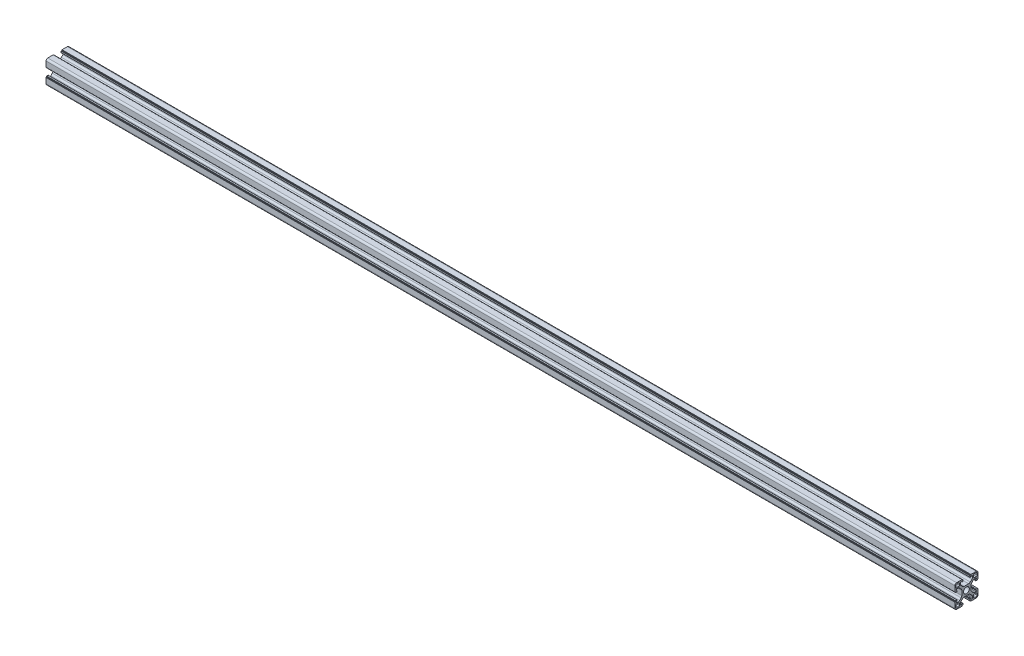
from build123d import *

# Parameters (mm, degrees)
EXTRUDE_1_DEPTH = 785


with BuildPart() as part:
    # Эскиз1 → Бобышка-Вытянуть1 (new body)
    with BuildSketch(Plane(origin=(0, 0, 0), x_dir=(0, 0, -1), z_dir=(1, 0, 0))):
        with BuildLine():
            Line((0.129852449, 4.683728486), (2.028633118, 4.683728486))
            ThreePointArc((2.028633118, 4.683728486), (2.793999983, 4.835969421), (3.44284668, 5.269514923))
            Line((3.44284668, 5.269514923), (4.744066011, 6.570734254))
            ThreePointArc((4.744066011, 6.570734254), (5.177611514, 7.219580952), (5.329852449, 7.984947817))
            Line((5.329852449, 7.984947817), (5.329852449, 8.883728486))
            ThreePointArc((5.329852449, 8.883728486), (5.183405839, 9.237281876), (4.829852449, 9.383728486))
            Line((4.829852449, 9.383728486), (4.72695923, 9.383728486))
            ThreePointArc((4.72695923, 9.383728486), (4.535617514, 9.345668252), (4.373405839, 9.237281876))
            Line((4.373405839, 9.237281876), (3.893075754, 8.75695179))
            ThreePointArc((3.893075754, 8.75695179), (3.811969916, 8.702758603), (3.716299058, 8.683728486))
            Line((3.716299058, 8.683728486), (3.429852449, 8.683728486))
            ThreePointArc((3.429852449, 8.683728486), (3.253075754, 8.75695179), (3.179852449, 8.933728486))
            Line((3.179852449, 8.933728486), (3.179852449, 10.082799306))
            ThreePointArc((3.179852449, 10.082799306), (3.223786432, 10.188865323), (3.329852449, 10.232799306))
            Line((3.329852449, 10.232799306), (3.829852449, 10.232799306))
            Line((3.829852449, 10.232799306), (3.829852449, 10.533728486))
            ThreePointArc((3.829852449, 10.533728486), (3.873786432, 10.639794503), (3.979852449, 10.683728486))
            Line((3.979852449, 10.683728486), (8.629852449, 10.683728486))
            ThreePointArc((8.629852449, 10.683728486), (9.690512621, 10.244388658), (10.129852449, 9.183728486))
            Line((10.129852449, 9.183728486), (10.129852449, 4.533728486))
            ThreePointArc((10.129852449, 4.533728486), (10.085918466, 4.427662469), (9.979852449, 4.383728486))
            Line((9.979852449, 4.383728486), (9.678923269, 4.383728486))
            Line((9.678923269, 4.383728486), (9.678923269, 3.883728486))
            ThreePointArc((9.678923269, 3.883728486), (9.634989287, 3.777662469), (9.528923269, 3.733728486))
            Line((9.528923269, 3.733728486), (8.379852449, 3.733728486))
            ThreePointArc((8.379852449, 3.733728486), (8.203075754, 3.80695179), (8.129852449, 3.983728486))
            Line((8.129852449, 3.983728486), (8.129852449, 4.270175095))
            ThreePointArc((8.129852449, 4.270175095), (8.148882566, 4.365845953), (8.203075754, 4.44695179))
            Line((8.203075754, 4.44695179), (8.683405839, 4.927281876))
            ThreePointArc((8.683405839, 4.927281876), (8.791792215, 5.089493551), (8.829852449, 5.280835267))
            Line((8.829852449, 5.280835267), (8.829852449, 5.383728486))
            ThreePointArc((8.829852449, 5.383728486), (8.683405839, 5.737281876), (8.329852449, 5.883728486))
            Line((8.329852449, 5.883728486), (7.43107178, 5.883728486))
            ThreePointArc((7.43107178, 5.883728486), (6.665704915, 5.731487551), (6.016858217, 5.297942048))
            Line((6.016858217, 5.297942048), (4.715638886, 3.996722717))
            ThreePointArc((4.715638886, 3.996722717), (4.282093384, 3.34787602), (4.129852449, 2.582509155))
            Line((4.129852449, 2.582509155), (4.129852449, 0.683728486))
            Line((4.129852449, 0.683728486), (4.129852449, -1.215052183))
            ThreePointArc((4.129852449, -1.215052183), (4.282093384, -1.980419048), (4.715638886, -2.629265746))
            Line((4.715638886, -2.629265746), (6.016858217, -3.930485077))
            ThreePointArc((6.016858217, -3.930485077), (6.665704915, -4.364030579), (7.43107178, -4.516271514))
            Line((7.43107178, -4.516271514), (8.329852449, -4.516271514))
            ThreePointArc((8.329852449, -4.516271514), (8.683405839, -4.369824905), (8.829852449, -4.016271514))
            Line((8.829852449, -4.016271514), (8.829852449, -3.913378295))
            ThreePointArc((8.829852449, -3.913378295), (8.791792215, -3.722036579), (8.683405839, -3.559824905))
            Line((8.683405839, -3.559824905), (8.203075754, -3.079494819))
            ThreePointArc((8.203075754, -3.079494819), (8.148882566, -2.998388982), (8.129852449, -2.902718124))
            Line((8.129852449, -2.902718124), (8.129852449, -2.616271514))
            ThreePointArc((8.129852449, -2.616271514), (8.203075754, -2.439494819), (8.379852449, -2.366271514))
            Line((8.379852449, -2.366271514), (9.528923269, -2.366271514))
            ThreePointArc((9.528923269, -2.366271514), (9.634989287, -2.410205497), (9.678923269, -2.516271514))
            Line((9.678923269, -2.516271514), (9.678923269, -3.016271514))
            Line((9.678923269, -3.016271514), (9.979852449, -3.016271514))
            ThreePointArc((9.979852449, -3.016271514), (10.085918466, -3.060205497), (10.129852449, -3.166271514))
            Line((10.129852449, -3.166271514), (10.129852449, -7.816271514))
            ThreePointArc((10.129852449, -7.816271514), (9.690512621, -8.876931686), (8.629852449, -9.316271514))
            Line((8.629852449, -9.316271514), (3.979852449, -9.316271514))
            ThreePointArc((3.979852449, -9.316271514), (3.873786432, -9.272337531), (3.829852449, -9.166271514))
            Line((3.829852449, -9.166271514), (3.829852449, -8.865342335))
            Line((3.829852449, -8.865342335), (3.329852449, -8.865342335))
            ThreePointArc((3.329852449, -8.865342335), (3.223786432, -8.821408352), (3.179852449, -8.715342335))
            Line((3.179852449, -8.715342335), (3.179852449, -7.566271514))
            ThreePointArc((3.179852449, -7.566271514), (3.253075754, -7.389494819), (3.429852449, -7.316271514))
            Line((3.429852449, -7.316271514), (3.716299058, -7.316271514))
            ThreePointArc((3.716299058, -7.316271514), (3.811969916, -7.335301631), (3.893075754, -7.389494819))
            Line((3.893075754, -7.389494819), (4.373405839, -7.869824905))
            ThreePointArc((4.373405839, -7.869824905), (4.535617514, -7.978211281), (4.72695923, -8.016271514))
            Line((4.72695923, -8.016271514), (4.829852449, -8.016271514))
            ThreePointArc((4.829852449, -8.016271514), (5.183405839, -7.869824905), (5.329852449, -7.516271514))
            Line((5.329852449, -7.516271514), (5.329852449, -6.617490845))
            ThreePointArc((5.329852449, -6.617490845), (5.177611514, -5.85212398), (4.744066011, -5.203277283))
            Line((4.744066011, -5.203277283), (3.44284668, -3.902057952))
            ThreePointArc((3.44284668, -3.902057952), (2.793999983, -3.468512449), (2.028633118, -3.316271514))
            Line((2.028633118, -3.316271514), (0.129852449, -3.316271514))
            Line((0.129852449, -3.316271514), (-1.76892822, -3.316271514))
            ThreePointArc((-1.76892822, -3.316271514), (-2.534295085, -3.468512449), (-3.183141783, -3.902057952))
            Line((-3.183141783, -3.902057952), (-4.484361114, -5.203277283))
            ThreePointArc((-4.484361114, -5.203277283), (-4.917906616, -5.85212398), (-5.070147551, -6.617490845))
            Line((-5.070147551, -6.617490845), (-5.070147551, -7.516271514))
            ThreePointArc((-5.070147551, -7.516271514), (-4.923700942, -7.869824905), (-4.570147551, -8.016271514))
            Line((-4.570147551, -8.016271514), (-4.467254332, -8.016271514))
            ThreePointArc((-4.467254332, -8.016271514), (-4.275912616, -7.978211281), (-4.113700942, -7.869824905))
            Line((-4.113700942, -7.869824905), (-3.633370856, -7.389494819))
            ThreePointArc((-3.633370856, -7.389494819), (-3.552265019, -7.335301631), (-3.456594161, -7.316271514))
            Line((-3.456594161, -7.316271514), (-3.170147551, -7.316271514))
            ThreePointArc((-3.170147551, -7.316271514), (-2.993370856, -7.389494819), (-2.920147551, -7.566271514))
            Line((-2.920147551, -7.566271514), (-2.920147551, -8.715342335))
            ThreePointArc((-2.920147551, -8.715342335), (-2.964081534, -8.821408352), (-3.070147551, -8.865342335))
            Line((-3.070147551, -8.865342335), (-3.570147551, -8.865342335))
            Line((-3.570147551, -8.865342335), (-3.570147551, -9.166271514))
            ThreePointArc((-3.570147551, -9.166271514), (-3.614081534, -9.272337531), (-3.720147551, -9.316271514))
            Line((-3.720147551, -9.316271514), (-8.370147551, -9.316271514))
            ThreePointArc((-8.370147551, -9.316271514), (-9.430807723, -8.876931686), (-9.870147551, -7.816271514))
            Line((-9.870147551, -7.816271514), (-9.870147551, -3.166271514))
            ThreePointArc((-9.870147551, -3.166271514), (-9.826213568, -3.060205497), (-9.720147551, -3.016271514))
            Line((-9.720147551, -3.016271514), (-9.419218372, -3.016271514))
            Line((-9.419218372, -3.016271514), (-9.419218372, -2.516271514))
            ThreePointArc((-9.419218372, -2.516271514), (-9.375284389, -2.410205497), (-9.269218372, -2.366271514))
            Line((-9.269218372, -2.366271514), (-8.120147551, -2.366271514))
            ThreePointArc((-8.120147551, -2.366271514), (-7.943370856, -2.439494819), (-7.870147551, -2.616271514))
            Line((-7.870147551, -2.616271514), (-7.870147551, -2.902718124))
            ThreePointArc((-7.870147551, -2.902718124), (-7.889177668, -2.998388982), (-7.943370856, -3.079494819))
            Line((-7.943370856, -3.079494819), (-8.423700942, -3.559824905))
            ThreePointArc((-8.423700942, -3.559824905), (-8.532087317, -3.722036579), (-8.570147551, -3.913378295))
            Line((-8.570147551, -3.913378295), (-8.570147551, -4.016271514))
            ThreePointArc((-8.570147551, -4.016271514), (-8.423700942, -4.369824905), (-8.070147551, -4.516271514))
            Line((-8.070147551, -4.516271514), (-7.171366882, -4.516271514))
            ThreePointArc((-7.171366882, -4.516271514), (-6.406000017, -4.364030579), (-5.75715332, -3.930485077))
            Line((-5.75715332, -3.930485077), (-4.455933989, -2.629265746))
            ThreePointArc((-4.455933989, -2.629265746), (-4.022388486, -1.980419048), (-3.870147551, -1.215052183))
            Line((-3.870147551, -1.215052183), (-3.870147551, 0.683728486))
            Line((-3.870147551, 0.683728486), (-3.870147551, 2.582509155))
            ThreePointArc((-3.870147551, 2.582509155), (-4.022388486, 3.34787602), (-4.455933989, 3.996722717))
            Line((-4.455933989, 3.996722717), (-5.75715332, 5.297942048))
            ThreePointArc((-5.75715332, 5.297942048), (-6.406000017, 5.731487551), (-7.171366882, 5.883728486))
            Line((-7.171366882, 5.883728486), (-8.070147551, 5.883728486))
            ThreePointArc((-8.070147551, 5.883728486), (-8.423700942, 5.737281876), (-8.570147551, 5.383728486))
            Line((-8.570147551, 5.383728486), (-8.570147551, 5.280835267))
            ThreePointArc((-8.570147551, 5.280835267), (-8.532087317, 5.089493551), (-8.423700942, 4.927281876))
            Line((-8.423700942, 4.927281876), (-7.943370856, 4.44695179))
            ThreePointArc((-7.943370856, 4.44695179), (-7.889177668, 4.365845953), (-7.870147551, 4.270175095))
            Line((-7.870147551, 4.270175095), (-7.870147551, 3.983728486))
            ThreePointArc((-7.870147551, 3.983728486), (-7.943370856, 3.80695179), (-8.120147551, 3.733728486))
            Line((-8.120147551, 3.733728486), (-9.269218372, 3.733728486))
            ThreePointArc((-9.269218372, 3.733728486), (-9.375284389, 3.777662469), (-9.419218372, 3.883728486))
            Line((-9.419218372, 3.883728486), (-9.419218372, 4.383728486))
            Line((-9.419218372, 4.383728486), (-9.720147551, 4.383728486))
            ThreePointArc((-9.720147551, 4.383728486), (-9.826213568, 4.427662469), (-9.870147551, 4.533728486))
            Line((-9.870147551, 4.533728486), (-9.870147551, 9.183728486))
            ThreePointArc((-9.870147551, 9.183728486), (-9.430807723, 10.244388658), (-8.370147551, 10.683728486))
            Line((-8.370147551, 10.683728486), (-3.720147551, 10.683728486))
            ThreePointArc((-3.720147551, 10.683728486), (-3.614081534, 10.639794503), (-3.570147551, 10.533728486))
            Line((-3.570147551, 10.533728486), (-3.570147551, 10.232799306))
            Line((-3.570147551, 10.232799306), (-3.070147551, 10.232799306))
            ThreePointArc((-3.070147551, 10.232799306), (-2.964081534, 10.188865323), (-2.920147551, 10.082799306))
            Line((-2.920147551, 10.082799306), (-2.920147551, 8.933728486))
            ThreePointArc((-2.920147551, 8.933728486), (-2.993370856, 8.75695179), (-3.170147551, 8.683728486))
            Line((-3.170147551, 8.683728486), (-3.456594161, 8.683728486))
            ThreePointArc((-3.456594161, 8.683728486), (-3.552265019, 8.702758603), (-3.633370856, 8.75695179))
            Line((-3.633370856, 8.75695179), (-4.113700942, 9.237281876))
            ThreePointArc((-4.113700942, 9.237281876), (-4.275912616, 9.345668252), (-4.467254332, 9.383728486))
            Line((-4.467254332, 9.383728486), (-4.570147551, 9.383728486))
            ThreePointArc((-4.570147551, 9.383728486), (-4.923700942, 9.237281876), (-5.070147551, 8.883728486))
            Line((-5.070147551, 8.883728486), (-5.070147551, 7.984947817))
            ThreePointArc((-5.070147551, 7.984947817), (-4.917906616, 7.219580952), (-4.484361114, 6.570734254))
            Line((-4.484361114, 6.570734254), (-3.183141783, 5.269514923))
            ThreePointArc((-3.183141783, 5.269514923), (-2.534295085, 4.835969421), (-1.76892822, 4.683728486))
            Line((-1.76892822, 4.683728486), (0.129852449, 4.683728486))
        make_face()
        with BuildLine():
            Line((7.029852449, 6.783728486), (8.429852449, 6.783728486))
            ThreePointArc((8.429852449, 6.783728486), (8.995537874, 7.018043061), (9.229852449, 7.583728486))
            Line((9.229852449, 7.583728486), (9.229852449, 8.983728486))
            ThreePointArc((9.229852449, 8.983728486), (8.995537874, 9.549413911), (8.429852449, 9.783728486))
            Line((8.429852449, 9.783728486), (7.029852449, 9.783728486))
            ThreePointArc((7.029852449, 9.783728486), (6.464167024, 9.549413911), (6.229852449, 8.983728486))
            Line((6.229852449, 8.983728486), (6.229852449, 7.583728486))
            ThreePointArc((6.229852449, 7.583728486), (6.464167024, 7.018043061), (7.029852449, 6.783728486))
        make_face(mode=Mode.SUBTRACT)
        with BuildLine():
            Line((6.229852449, -6.216271514), (6.229852449, -7.616271514))
            ThreePointArc((6.229852449, -7.616271514), (6.464167024, -8.181956939), (7.029852449, -8.416271514))
            Line((7.029852449, -8.416271514), (8.429852449, -8.416271514))
            ThreePointArc((8.429852449, -8.416271514), (8.995537874, -8.181956939), (9.229852449, -7.616271514))
            Line((9.229852449, -7.616271514), (9.229852449, -6.216271514))
            ThreePointArc((9.229852449, -6.216271514), (8.995537874, -5.650586089), (8.429852449, -5.416271514))
            Line((8.429852449, -5.416271514), (7.029852449, -5.416271514))
            ThreePointArc((7.029852449, -5.416271514), (6.464167024, -5.650586089), (6.229852449, -6.216271514))
        make_face(mode=Mode.SUBTRACT)
        with BuildLine():
            Line((-6.770147551, -5.416271514), (-8.170147551, -5.416271514))
            ThreePointArc((-8.170147551, -5.416271514), (-8.735832976, -5.650586089), (-8.970147551, -6.216271514))
            Line((-8.970147551, -6.216271514), (-8.970147551, -7.616271514))
            ThreePointArc((-8.970147551, -7.616271514), (-8.735832976, -8.181956939), (-8.170147551, -8.416271514))
            Line((-8.170147551, -8.416271514), (-6.770147551, -8.416271514))
            ThreePointArc((-6.770147551, -8.416271514), (-6.204462126, -8.181956939), (-5.970147551, -7.616271514))
            Line((-5.970147551, -7.616271514), (-5.970147551, -6.216271514))
            ThreePointArc((-5.970147551, -6.216271514), (-6.204462126, -5.650586089), (-6.770147551, -5.416271514))
        make_face(mode=Mode.SUBTRACT)
        with BuildLine():
            Line((-5.970147551, 7.583728486), (-5.970147551, 8.983728486))
            ThreePointArc((-5.970147551, 8.983728486), (-6.204462126, 9.549413911), (-6.770147551, 9.783728486))
            Line((-6.770147551, 9.783728486), (-8.170147551, 9.783728486))
            ThreePointArc((-8.170147551, 9.783728486), (-8.735832976, 9.549413911), (-8.970147551, 8.983728486))
            Line((-8.970147551, 8.983728486), (-8.970147551, 7.583728486))
            ThreePointArc((-8.970147551, 7.583728486), (-8.735832976, 7.018043061), (-8.170147551, 6.783728486))
            Line((-8.170147551, 6.783728486), (-6.770147551, 6.783728486))
            ThreePointArc((-6.770147551, 6.783728486), (-6.204462126, 7.018043061), (-5.970147551, 7.583728486))
        make_face(mode=Mode.SUBTRACT)
        with BuildLine():
            ThreePointArc((2.629852449, 0.683728486), (1.897619402, 2.451495439), (0.129852449, 3.183728486))
            ThreePointArc((0.129852449, 3.183728486), (-1.637914504, 2.451495439), (-2.370147551, 0.683728486))
            ThreePointArc((-2.370147551, 0.683728486), (-1.637914504, -1.084038467), (0.129852449, -1.816271514))
            ThreePointArc((0.129852449, -1.816271514), (1.897619402, -1.084038467), (2.629852449, 0.683728486))
        make_face(mode=Mode.SUBTRACT)
    extrude(amount=EXTRUDE_1_DEPTH)


solid = part.part
